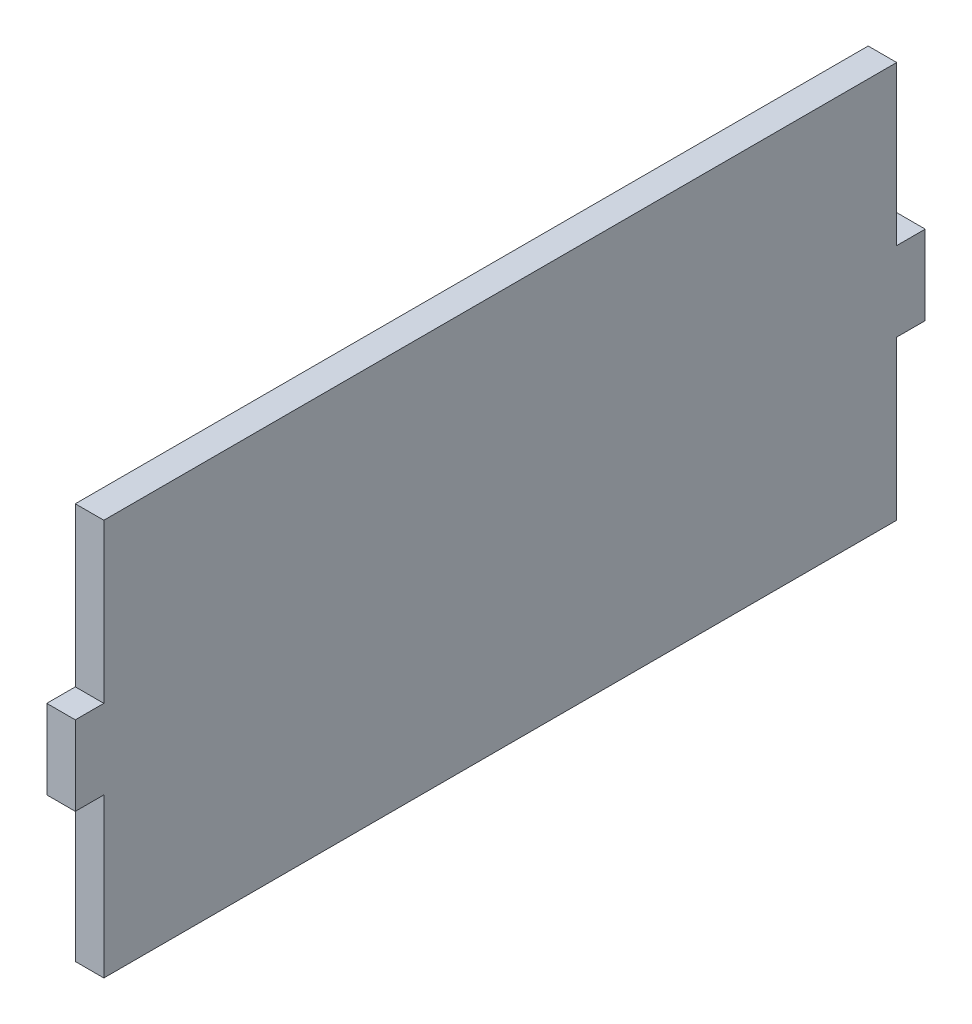
from build123d import *

# Parameters (mm, degrees)
BOSS_EXTRUDE1_DEPTH = 18


with BuildPart() as part:
    # Sketch1 → Boss-Extrude1 (new body)
    with BuildSketch(Plane(origin=(0, 0, 0), x_dir=(0, 0, -1), z_dir=(1, 0, 0))):
        Polygon((0, 0), (500, 0), (500, -100), (518, -100), (518, -150), (500, -150), (500, -250), (0, -250), (0, -150), (-18, -150), (-18, -100), (0, -100), align=None)
    extrude(amount=BOSS_EXTRUDE1_DEPTH)


solid = part.part
